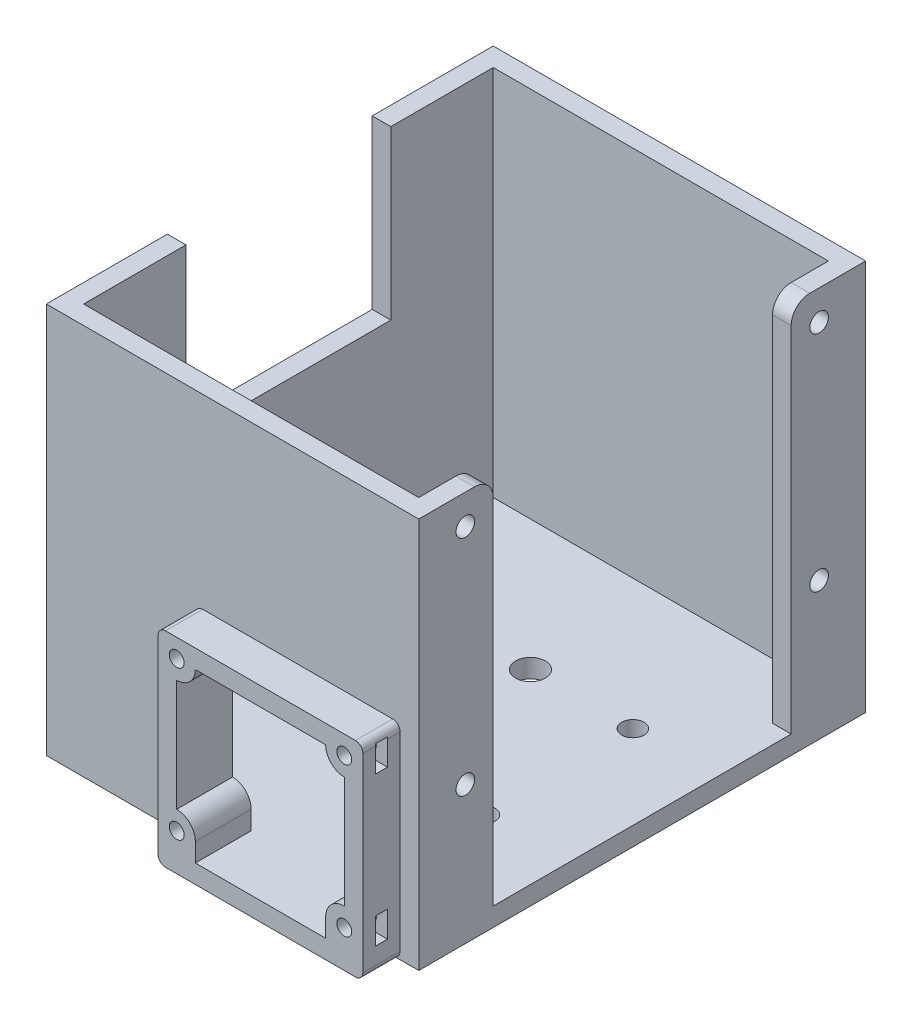
from build123d import *

# Parameters (mm, degrees)
CROQUIS1_W              = 100
CROQUIS1_H              = 120
SALIENTE_EXTRUIR1_DEPTH = 5
CORTAR_EXTRUIR5_REACH   = 80.262
CROQUIS6_R              = 3
CROQUIS6_R_2            = 4
SALIENTE_EXTRUIR2_DEPTH = 100
CROQUIS8_W              = 55
CROQUIS8_H              = 45
CORTAR_EXTRUIR6_DEPTH   = 157.923548265
CORTAR_EXTRUIR8_REACH   = 169.108
SALIENTE_EXTRUIR4_START = 10
CROQUIS13_R             = 2
SALIENTE_EXTRUIR4_DEPTH = 10
CORTAR_EXTRUIR9_DEPTH   = 1.6
CORTAR_EXTRUIR10_REACH  = 163.012
CROQUIS16_R             = 2.5
REDONDEO1_R             = 5


with BuildPart() as part:
    # Croquis1 → Saliente-Extruir1 (new body)
    with BuildSketch(Plane(origin=(0, 0, 0), x_dir=(1, 0, 0), z_dir=(0, 1, 0))):
        Rectangle(CROQUIS1_W, CROQUIS1_H)
    extrude(amount=SALIENTE_EXTRUIR1_DEPTH)

    # Croquis6 → Cortar-Extruir5 (cut, up to next)
    with BuildSketch(Plane(origin=(0, 0, 0), x_dir=(1, 0, 0), z_dir=(0, 1, 0)), mode=Mode.PRIVATE) as cortar_extruir5_sk1:
        with Locations(Location((27.5, -20, 0), (0, 0, 90))):
            Circle(CROQUIS6_R)
    cortar_extruir5_tool1 = extrude(cortar_extruir5_sk1.sketch, amount=CORTAR_EXTRUIR5_REACH, mode=Mode.PRIVATE) & part.part
    # Croquis6 → Cortar-Extruir5 (cut, up to next)
    with BuildSketch(Plane(origin=(0, 0, 0), x_dir=(1, 0, 0), z_dir=(0, 1, 0)), mode=Mode.PRIVATE) as cortar_extruir5_sk2:
        with Locations(Location((0, -20, 0), (0, 0, 90))):
            Circle(CROQUIS6_R_2)
    cortar_extruir5_tool2 = extrude(cortar_extruir5_sk2.sketch, amount=CORTAR_EXTRUIR5_REACH, mode=Mode.PRIVATE) & part.part
    # Croquis6 → Cortar-Extruir5 (cut, up to next)
    with BuildSketch(Plane(origin=(0, 0, 0), x_dir=(1, 0, 0), z_dir=(0, 1, 0)), mode=Mode.PRIVATE) as cortar_extruir5_sk3:
        with Locations(Location((-27.5, -20, 0), (0, 0, 90))):
            Circle(CROQUIS6_R)
    cortar_extruir5_tool3 = extrude(cortar_extruir5_sk3.sketch, amount=CORTAR_EXTRUIR5_REACH, mode=Mode.PRIVATE) & part.part
    # Croquis6 → Cortar-Extruir5 (cut, up to next)
    with BuildSketch(Plane(origin=(0, 0, 0), x_dir=(1, 0, 0), z_dir=(0, 1, 0)), mode=Mode.PRIVATE) as cortar_extruir5_sk4:
        with Locations(Location((-27.5, 20, 0), (0, 0, 90))):
            Circle(CROQUIS6_R)
    cortar_extruir5_tool4 = extrude(cortar_extruir5_sk4.sketch, amount=CORTAR_EXTRUIR5_REACH, mode=Mode.PRIVATE) & part.part
    # Croquis6 → Cortar-Extruir5 (cut, up to next)
    with BuildSketch(Plane(origin=(0, 0, 0), x_dir=(1, 0, 0), z_dir=(0, 1, 0)), mode=Mode.PRIVATE) as cortar_extruir5_sk5:
        with Locations(Location((0, 20, 0), (0, 0, 90))):
            Circle(CROQUIS6_R_2)
    cortar_extruir5_tool5 = extrude(cortar_extruir5_sk5.sketch, amount=CORTAR_EXTRUIR5_REACH, mode=Mode.PRIVATE) & part.part
    # Croquis6 → Cortar-Extruir5 (cut, up to next)
    with BuildSketch(Plane(origin=(0, 0, 0), x_dir=(1, 0, 0), z_dir=(0, 1, 0)), mode=Mode.PRIVATE) as cortar_extruir5_sk6:
        with Locations(Location((27.5, 20, 0), (0, 0, 90))):
            Circle(CROQUIS6_R)
    cortar_extruir5_tool6 = extrude(cortar_extruir5_sk6.sketch, amount=CORTAR_EXTRUIR5_REACH, mode=Mode.PRIVATE) & part.part
    add(cortar_extruir5_tool1.solids().sort_by_distance((27.5, 0, 20))[0], mode=Mode.SUBTRACT)
    add(cortar_extruir5_tool2.solids().sort_by_distance((0, 0, 20))[0], mode=Mode.SUBTRACT)
    add(cortar_extruir5_tool3.solids().sort_by_distance((-27.5, 0, 20))[0], mode=Mode.SUBTRACT)
    add(cortar_extruir5_tool4.solids().sort_by_distance((-27.5, 0, -20))[0], mode=Mode.SUBTRACT)
    add(cortar_extruir5_tool5.solids().sort_by_distance((0, 0, -20))[0], mode=Mode.SUBTRACT)
    add(cortar_extruir5_tool6.solids().sort_by_distance((27.5, 0, -20))[0], mode=Mode.SUBTRACT)

    # Croquis7 → Saliente-Extruir2 (add)
    with BuildSketch(Plane(origin=(0, 5, 0), x_dir=(1, 0, 0), z_dir=(0, 1, 0))):
        Polygon((45, 40), (50, 40), (50, 60), (-50, 60), (-50, -60), (50, -60), (50, -40), (45, -40), (45, -55), (-45, -55), (-45, 55), (45, 55), align=None)
    extrude(amount=SALIENTE_EXTRUIR2_DEPTH)

    # Croquis8 → Cortar-Extruir6 (cut, through all)
    with BuildSketch(Plane(origin=(50, 0, 0), x_dir=(0, 0, -1), z_dir=(1, 0, 0))):
        with Locations((0, 82.5)):
            Rectangle(CROQUIS8_W, CROQUIS8_H)
    extrude(amount=-CORTAR_EXTRUIR6_DEPTH, mode=Mode.SUBTRACT)

    # Croquis12 → Cortar-Extruir8 (cut, up to next)
    with BuildSketch(Plane.XY.offset(60), mode=Mode.PRIVATE) as cortar_extruir8_sk1:
        with BuildLine():
            Line((0, 5), (35, 5))
            Line((35, 5), (35, 10))
            ThreePointArc((35, 10), (36.464466094, 13.535533906), (40, 15))
            Line((40, 15), (40, 45))
            ThreePointArc((40, 45), (36.464466094, 46.464466094), (35, 50))
            Line((35, 50), (0, 50))
            ThreePointArc((0, 50), (-1.464466094, 46.464466094), (-5, 45))
            Line((-5, 45), (-5, 15))
            ThreePointArc((-5, 15), (-1.464466094, 13.535533906), (0, 10))
            Line((0, 10), (0, 5))
        make_face()
    cortar_extruir8_tool1 = extrude(cortar_extruir8_sk1.sketch, amount=-CORTAR_EXTRUIR8_REACH, mode=Mode.PRIVATE) & part.part
    add(cortar_extruir8_tool1.solids().sort_by_distance((17.5, 27.923763, 60))[0], mode=Mode.SUBTRACT)

    # Croquis13 → Saliente-Extruir4 (add)
    with BuildSketch(Plane.XY.offset(60).offset(SALIENTE_EXTRUIR4_START)):
        with BuildLine():
            Line((-8, 0), (43, 0))
            ThreePointArc((43, 0), (44.414213562, 0.585786438), (45, 2))
            Line((45, 2), (45, 53))
            ThreePointArc((45, 53), (44.414213562, 54.414213562), (43, 55))
            Line((43, 55), (-8, 55))
            ThreePointArc((-8, 55), (-9.414213562, 54.414213562), (-10, 53))
            Line((-10, 53), (-10, 2))
            ThreePointArc((-10, 2), (-9.414213562, 0.585786438), (-8, 0))
        make_face()
        with Locations((-5, 50)):
            Circle(CROQUIS13_R, mode=Mode.SUBTRACT)
        with Locations((40, 50)):
            Circle(CROQUIS13_R, mode=Mode.SUBTRACT)
        with Locations((40, 10)):
            Circle(CROQUIS13_R, mode=Mode.SUBTRACT)
        with Locations((-5, 10)):
            Circle(CROQUIS13_R, mode=Mode.SUBTRACT)
        with BuildLine():
            Line((0, 5), (35, 5))
            Line((35, 5), (35, 10))
            ThreePointArc((35, 10), (36.464466094, 13.535533906), (40, 15))
            Line((40, 15), (40, 45))
            ThreePointArc((40, 45), (36.464466094, 46.464466094), (35, 50))
            Line((35, 50), (0, 50))
            ThreePointArc((0, 50), (-1.464466094, 46.464466094), (-5, 45))
            Line((-5, 45), (-5, 15))
            ThreePointArc((-5, 15), (-1.464466094, 13.535533906), (0, 10))
            Line((0, 10), (0, 5))
        make_face(mode=Mode.SUBTRACT)
    extrude(amount=-SALIENTE_EXTRUIR4_DEPTH)

    # Croquis15 → Cortar-Extruir9 (cut, symmetric)
    with BuildSketch(Plane.XY.offset(65)):
        Polygon((42.020725942, 53.5), (45, 53.5), (45, 46.5), (42.020725942, 46.5), (37.979274058, 46.5), (35.958548116, 50), (37.979274058, 53.5), align=None)
        Polygon((-0.958548116, 50), (-2.979274058, 53.5), (-7.020725942, 53.5), (-10, 53.5), (-10, 46.5), (-7.020725942, 46.5), (-2.979274058, 46.5), align=None)
        Polygon((35.958548116, 10), (37.979274058, 6.5), (42.020725942, 6.5), (45, 6.5), (45, 13.5), (42.020725942, 13.5), (37.979274058, 13.5), align=None)
        Polygon((-0.958548116, 10), (-2.979274058, 13.5), (-7.020725942, 13.5), (-10, 13.5), (-10, 6.5), (-7.020725942, 6.5), (-2.979274058, 6.5), align=None)
    extrude(amount=CORTAR_EXTRUIR9_DEPTH, both=True, mode=Mode.SUBTRACT)

    # Croquis16 → Cortar-Extruir10 (cut, up to next)
    with BuildSketch(Plane(origin=(50, 0, 0), x_dir=(0, 0, -1), z_dir=(1, 0, 0)), mode=Mode.PRIVATE) as cortar_extruir10_sk1:
        with Locations((-47.5, 97)):
            Circle(CROQUIS16_R)
    cortar_extruir10_tool1 = extrude(cortar_extruir10_sk1.sketch, amount=-CORTAR_EXTRUIR10_REACH, mode=Mode.PRIVATE) & part.part
    # Croquis16 → Cortar-Extruir10 (cut, up to next)
    with BuildSketch(Plane(origin=(50, 0, 0), x_dir=(0, 0, -1), z_dir=(1, 0, 0)), mode=Mode.PRIVATE) as cortar_extruir10_sk2:
        with Locations((-47.5, 37)):
            Circle(CROQUIS16_R)
    cortar_extruir10_tool2 = extrude(cortar_extruir10_sk2.sketch, amount=-CORTAR_EXTRUIR10_REACH, mode=Mode.PRIVATE) & part.part
    # Croquis16 → Cortar-Extruir10 (cut, up to next)
    with BuildSketch(Plane(origin=(50, 0, 0), x_dir=(0, 0, -1), z_dir=(1, 0, 0)), mode=Mode.PRIVATE) as cortar_extruir10_sk3:
        with Locations((47.5, 97)):
            Circle(CROQUIS16_R)
    cortar_extruir10_tool3 = extrude(cortar_extruir10_sk3.sketch, amount=-CORTAR_EXTRUIR10_REACH, mode=Mode.PRIVATE) & part.part
    # Croquis16 → Cortar-Extruir10 (cut, up to next)
    with BuildSketch(Plane(origin=(50, 0, 0), x_dir=(0, 0, -1), z_dir=(1, 0, 0)), mode=Mode.PRIVATE) as cortar_extruir10_sk4:
        with Locations((47.5, 37)):
            Circle(CROQUIS16_R)
    cortar_extruir10_tool4 = extrude(cortar_extruir10_sk4.sketch, amount=-CORTAR_EXTRUIR10_REACH, mode=Mode.PRIVATE) & part.part
    add(cortar_extruir10_tool1.solids().sort_by_distance((50, 97, 47.5))[0], mode=Mode.SUBTRACT)
    add(cortar_extruir10_tool2.solids().sort_by_distance((50, 37, 47.5))[0], mode=Mode.SUBTRACT)
    add(cortar_extruir10_tool3.solids().sort_by_distance((50, 97, -47.5))[0], mode=Mode.SUBTRACT)
    add(cortar_extruir10_tool4.solids().sort_by_distance((50, 37, -47.5))[0], mode=Mode.SUBTRACT)

    # Redondeo1
    redondeo1_edges = [part.edges().sort_by_distance(p)[0] for p in [
        (47.5, 105, 40),
        (47.5, 105, -40),
    ]]
    fillet(redondeo1_edges, radius=REDONDEO1_R)


solid = part.part
